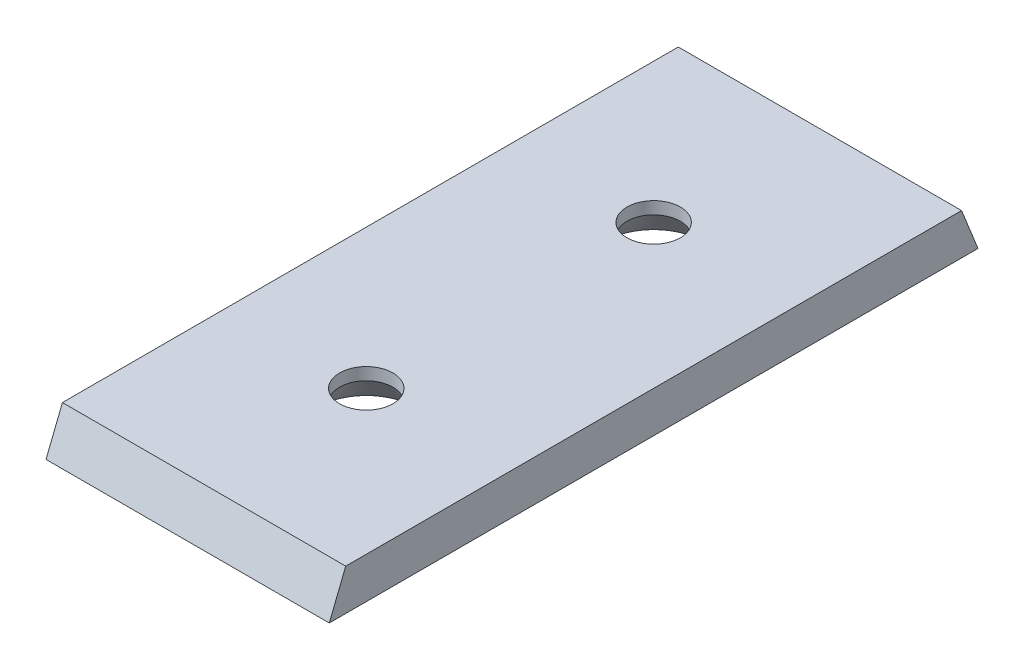
from build123d import *

# Parameters (mm, degrees)
SKETCH_1_W                          = 69
SKETCH_1_H                          = 158
EXTRUDE_1_DEPTH                     = 10
CUT_EXTRUDE_2_REACH                 = 88.783
SKETCH_4_R                          = 6.5
CHAMFER_1_SIZE                      = 5.5
CHAMFER_1_SIZE2                     = 7
PATTERN_LINEAR_2_COUNT              = 2
PATTERN_LINEAR_2_PITCH              = 70
CHAMFER_1_OF_PATTERN_LINEAR_2_SIZE2 = 7
CHAMFER_1_OF_PATTERN_LINEAR_2_SIZE  = 5.5
CUT_EXTRUDE_3_REACH                 = 107.366


with BuildPart() as part:
    # 草图1 → 凸台-拉伸1 (new body)
    with BuildSketch(Plane(origin=(0, 0, 0), x_dir=(1, 0, 0), z_dir=(0, 1, 0))):
        Rectangle(SKETCH_1_W, SKETCH_1_H)
    extrude(amount=EXTRUDE_1_DEPTH)

    # 草图4 → 切除-拉伸2 (cut, up to next)
    with BuildSketch(Plane.XZ, mode=Mode.PRIVATE) as cut_extrude_2_sk1:
        with Locations(Location((-0.5, 35, 0), (0, 0, 270))):
            Circle(SKETCH_4_R)
    cut_extrude_2_tool1 = extrude(cut_extrude_2_sk1.sketch, amount=-CUT_EXTRUDE_2_REACH, mode=Mode.PRIVATE) & part.part
    cut_extrude_2 = cut_extrude_2_tool1.solids().sort_by_distance((-0.5, 0, 35))[0]
    add(cut_extrude_2, mode=Mode.SUBTRACT)

    # 倒角1
    chamfer_1_edges = [part.edges().sort_by_distance(p)[0] for p in [
        (-0.5, 0, 41.5),
    ]]
    chamfer_1_side = [part.faces().sort_by_distance(p)[0] for p in [
        (0.006162549, 0, -0.431378462),
    ]]
    chamfer(chamfer_1_edges, length=CHAMFER_1_SIZE, length2=CHAMFER_1_SIZE2, reference=chamfer_1_side[0])

    # 阵列(线性)2: 切除-拉伸2 ×2
    with Locations(*[(0, 0, -i * PATTERN_LINEAR_2_PITCH) for i in range(1, PATTERN_LINEAR_2_COUNT)]):
        add(cut_extrude_2, mode=Mode.SUBTRACT)

    # 倒角1 of 阵列(线性)2
    chamfer_1_of_pattern_linear_2_edges = [part.edges().sort_by_distance(p)[0] for p in [
        (-0.5, 0, -28.5),
    ]]
    chamfer(chamfer_1_of_pattern_linear_2_edges, length=CHAMFER_1_OF_PATTERN_LINEAR_2_SIZE, length2=CHAMFER_1_OF_PATTERN_LINEAR_2_SIZE2)

    # 草图6 → 切除-拉伸3 (cut, up to next)
    with BuildSketch(Plane(origin=(34.5, 0, 0), x_dir=(0, 0, -1), z_dir=(1, 0, 0)), mode=Mode.PRIVATE) as cut_extrude_3_sk1:
        Polygon((-79, 0), (-75.000285359, 10), (-79, 10), align=None)
    cut_extrude_3_tool1 = extrude(cut_extrude_3_sk1.sketch, amount=-CUT_EXTRUDE_3_REACH, mode=Mode.PRIVATE) & part.part
    # 草图6 → 切除-拉伸3 (cut, up to next)
    with BuildSketch(Plane(origin=(34.5, 0, 0), x_dir=(0, 0, -1), z_dir=(1, 0, 0)), mode=Mode.PRIVATE) as cut_extrude_3_sk2:
        Polygon((79, 10), (79, 0), (75.000285359, 10), align=None)
    cut_extrude_3_tool2 = extrude(cut_extrude_3_sk2.sketch, amount=-CUT_EXTRUDE_3_REACH, mode=Mode.PRIVATE) & part.part
    add(cut_extrude_3_tool1.solids().sort_by_distance((34.5, 6.666667, 77.666762))[0], mode=Mode.SUBTRACT)
    add(cut_extrude_3_tool2.solids().sort_by_distance((34.5, 6.666667, -77.666762))[0], mode=Mode.SUBTRACT)


solid = part.part
